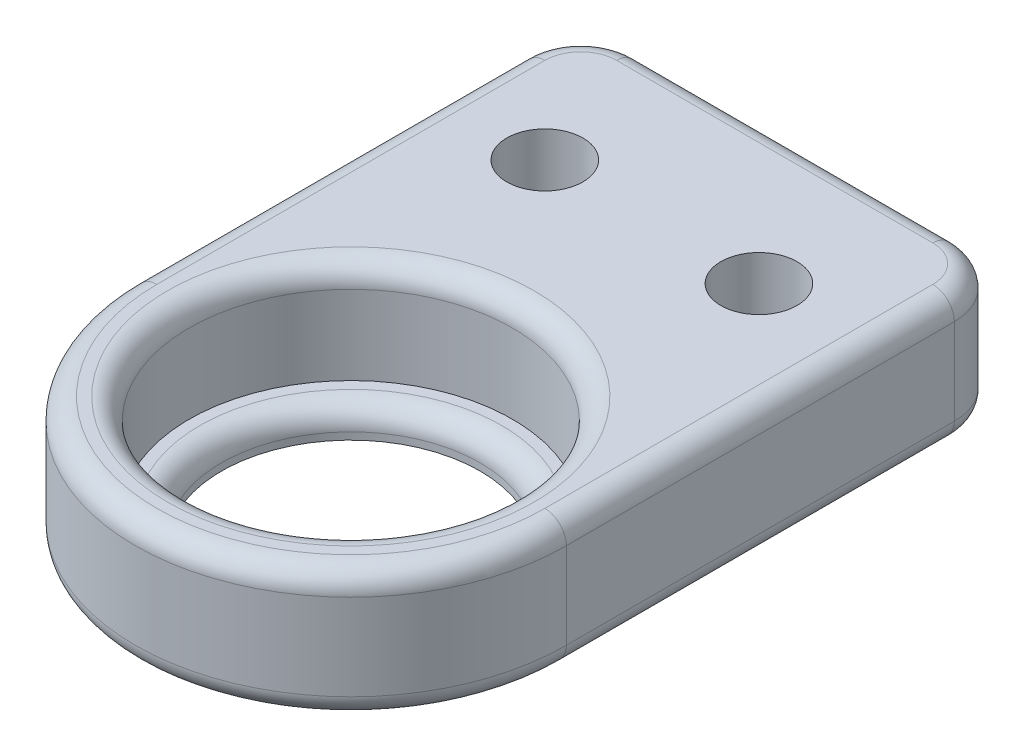
from build123d import *

# Parameters (mm, degrees)
SKETCH2_R                     = 11.25
BOSS_EXTRUDE1_DEPTH           = 9
SKETCH2_3_R                   = 11.25
SKETCH2_3_R_2                 = 9
BOSS_EXTRUDE2_DEPTH           = 2
CSK_FOR_M5_SFHCS1_D           = 5.3
CSK_FOR_M5_SFHCS1_CSINK_D     = 11.2
CSK_FOR_M5_SFHCS1_CSINK_ANGLE = 90
FILLET1_R                     = 4
FILLET2_R                     = 1.5


with BuildPart() as part:
    # Sketch2 → Boss-Extrude1 (new body)
    with BuildSketch(Plane(origin=(0, 0, 0), x_dir=(1, 0, 0), z_dir=(0, 1, 0))):
        with BuildLine():
            Line((-15, 31), (-15, 0))
            ThreePointArc((-15, 0), (0, -15), (15, 0))
            Line((15, 0), (15, 31))
            Line((15, 31), (-15, 31))
        make_face()
        Circle(SKETCH2_R, mode=Mode.SUBTRACT)
    extrude(amount=BOSS_EXTRUDE1_DEPTH)

    # Sketch2<3> → Boss-Extrude2 (add)
    with BuildSketch(Plane(origin=(0, 0, 0), x_dir=(1, 0, 0), z_dir=(0, 1, 0))):
        Circle(SKETCH2_3_R)
        Circle(SKETCH2_3_R_2, mode=Mode.SUBTRACT)
    extrude(amount=BOSS_EXTRUDE2_DEPTH)

    # CSK for M5 SFHCS1 (through all)
    with Locations(Plane(origin=(7.4, 0, -21), x_dir=(0, 0, -1), z_dir=(0, -1, 0))):
        with Locations((0, 0), (0, -14.9)):
            CounterSinkHole(CSK_FOR_M5_SFHCS1_D / 2, CSK_FOR_M5_SFHCS1_CSINK_D / 2, counter_sink_angle=CSK_FOR_M5_SFHCS1_CSINK_ANGLE)

    # Fillet1
    fillet1_edges = [part.edges().sort_by_distance(p)[0] for p in [
        (-15, 4.5, -31),
        (15, 4.5, -31),
    ]]
    fillet(fillet1_edges, radius=FILLET1_R)

    # Fillet2
    fillet2_edges = [part.edges().sort_by_distance(p)[0] for p in [
        (0, 0, 15),
        (-15, 0, -13.5),
        (-13.828427125, 0, -29.828427125),
        (0, 0, -31),
        (13.828427125, 0, -29.828427125),
        (0, 9, 15),
        (-15, 9, -13.5),
        (-13.828427125, 9, -29.828427125),
        (0, 9, -31),
        (13.828427125, 9, -29.828427125),
        (-9, 2, 0),
        (-11.25, 9, 0),
        (15, 0, -13.5),
        (15, 9, -13.5),
    ]]
    fillet(fillet2_edges, radius=FILLET2_R)


solid = part.part
